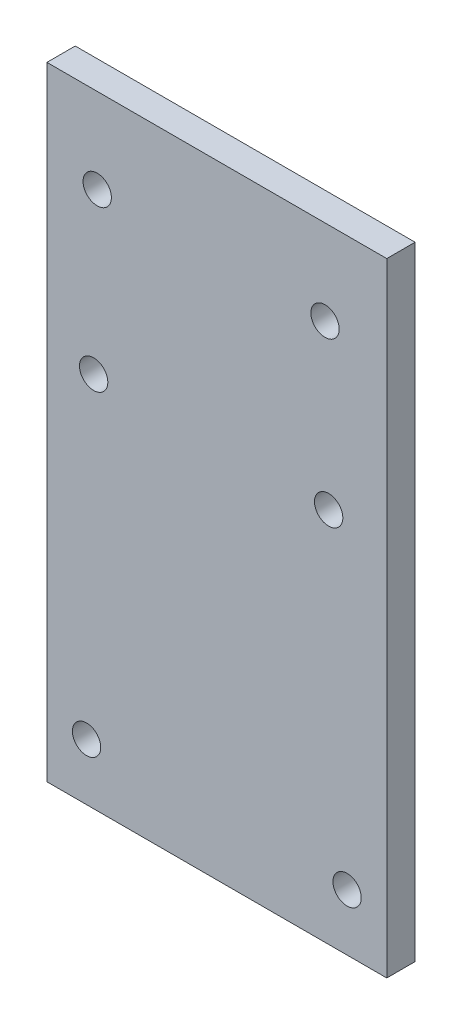
from build123d import *

# Parameters (mm, degrees)
SKETCH1_W           = 60
SKETCH1_H           = 110
SKETCH1_R           = 2.5
BOSS_EXTRUDE1_DEPTH = 5


with BuildPart() as part:
    # Sketch1 → Boss-Extrude1 (new body)
    with BuildSketch(Plane.XY):
        with Locations((30, -55)):
            Rectangle(SKETCH1_W, SKETCH1_H)
        with Locations((8.879726404, -15)):
            Circle(SKETCH1_R, mode=Mode.SUBTRACT)
        with Locations((49.096380092, -15)):
            Circle(SKETCH1_R, mode=Mode.SUBTRACT)
        with Locations((49.743242135, -43.54)):
            Circle(SKETCH1_R, mode=Mode.SUBTRACT)
        with Locations((8.252207519, -43.54)):
            Circle(SKETCH1_R, mode=Mode.SUBTRACT)
        with Locations((7, -100)):
            Circle(SKETCH1_R, mode=Mode.SUBTRACT)
        with Locations(Location((53, -100, 0), (0, 0, 180))):
            Circle(SKETCH1_R, mode=Mode.SUBTRACT)
    extrude(amount=BOSS_EXTRUDE1_DEPTH)


solid = part.part
